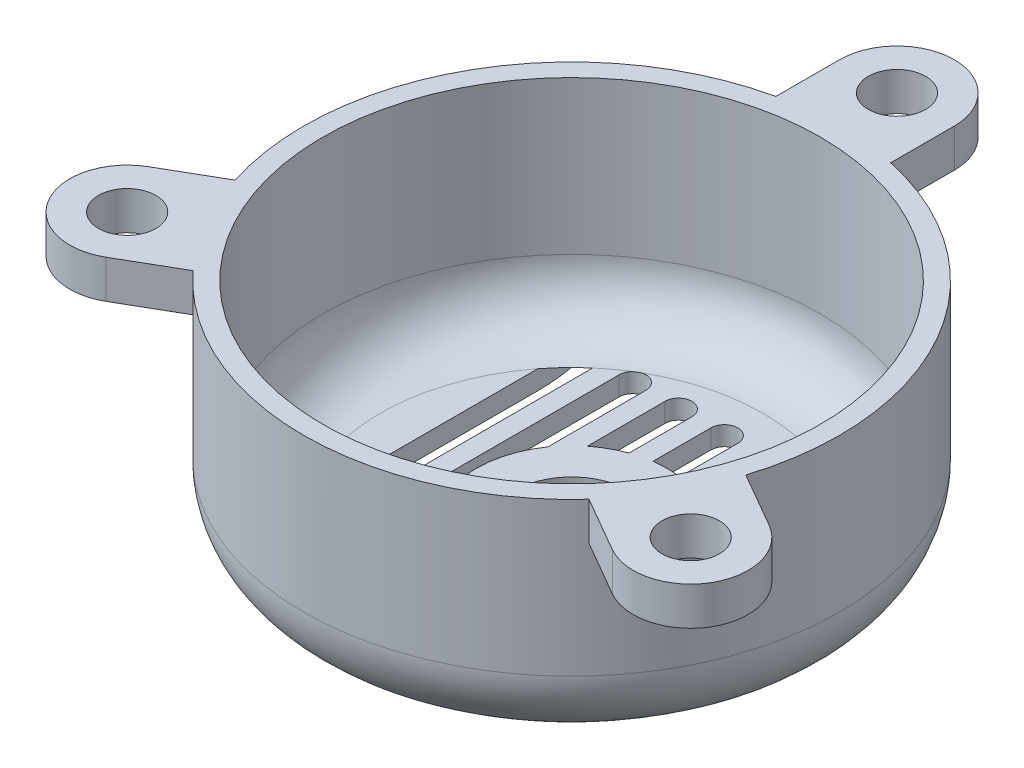
from build123d import *

# Parameters (mm, degrees)
SKETCH2_R           = 88.9
BOSS_EXTRUDE1_DEPTH = 76.2
FILLET1_R           = 25.4
SHELL1_T            = -6.35
CUT_EXTRUDE1_REACH  = 145.824
SKETCH6_R           = 31.75
BOSS_EXTRUDE2_DEPTH = 19.05
CUT_EXTRUDE2_REACH  = 155.979
SKETCH7_R           = 19.05
BOSS_EXTRUDE3_START = -12.7
SKETCH9_R           = 9.525
BOSS_EXTRUDE3_DEPTH = 12.7
CIRPATTERN1_COUNT   = 3


with BuildPart() as part:
    # Sketch2 → Boss-Extrude1 (new body)
    with BuildSketch(Plane(origin=(0, 0, 0), x_dir=(1, 0, 0), z_dir=(0, 1, 0))):
        with Locations(Location((0, 0, 0), (0, 0, 90))):
            Circle(SKETCH2_R)
    extrude(amount=BOSS_EXTRUDE1_DEPTH)

    # Fillet1
    fillet1_edges = [part.edges().sort_by_distance(p)[0] for p in [
        (0, 0, 88.9),
    ]]
    fillet(fillet1_edges, radius=FILLET1_R)

    # Shell1
    shell1_openings = [part.faces().sort_by_distance(p)[0] for p in [
        (0, 76.2, 0),
    ]]
    offset(amount=SHELL1_T, openings=shell1_openings, kind=Kind.INTERSECTION)

    # Sketch3 → Cut-Extrude1 (cut, up to next)
    with BuildSketch(Plane(origin=(0, 6.35, 0), x_dir=(1, 0, 0), z_dir=(0, 1, 0)), mode=Mode.PRIVATE) as cut_extrude1_sk1:
        with BuildLine():
            Line((50.165, 50.699645362), (50.165, -50.900354638))
            ThreePointArc((50.165, -50.900354638), (45.72, -55.345354638), (41.275, -50.900354638))
            Line((41.275, -50.900354638), (41.275, 50.699645362))
            ThreePointArc((41.275, 50.699645362), (45.72, 55.144645362), (50.165, 50.699645362))
        make_face()
    cut_extrude1_tool1 = extrude(cut_extrude1_sk1.sketch, amount=-CUT_EXTRUDE1_REACH, mode=Mode.PRIVATE) & part.part
    # Sketch3 → Cut-Extrude1 (cut, up to next)
    with BuildSketch(Plane(origin=(0, 6.35, 0), x_dir=(1, 0, 0), z_dir=(0, 1, 0)), mode=Mode.PRIVATE) as cut_extrude1_sk2:
        with BuildLine():
            Line((26.035, 50.699645362), (26.035, -50.900354638))
            ThreePointArc((26.035, -50.900354638), (30.48, -55.345354638), (34.925, -50.900354638))
            Line((34.925, -50.900354638), (34.925, 50.699645362))
            ThreePointArc((34.925, 50.699645362), (30.48, 55.144645362), (26.035, 50.699645362))
        make_face()
    cut_extrude1_tool2 = extrude(cut_extrude1_sk2.sketch, amount=-CUT_EXTRUDE1_REACH, mode=Mode.PRIVATE) & part.part
    # Sketch3 → Cut-Extrude1 (cut, up to next)
    with BuildSketch(Plane(origin=(0, 6.35, 0), x_dir=(1, 0, 0), z_dir=(0, 1, 0)), mode=Mode.PRIVATE) as cut_extrude1_sk3:
        with BuildLine():
            Line((10.795, 50.699645362), (10.795, -50.900354638))
            ThreePointArc((10.795, -50.900354638), (15.24, -55.345354638), (19.685, -50.900354638))
            Line((19.685, -50.900354638), (19.685, 50.699645362))
            ThreePointArc((19.685, 50.699645362), (15.24, 55.144645362), (10.795, 50.699645362))
        make_face()
    cut_extrude1_tool3 = extrude(cut_extrude1_sk3.sketch, amount=-CUT_EXTRUDE1_REACH, mode=Mode.PRIVATE) & part.part
    # Sketch3 → Cut-Extrude1 (cut, up to next)
    with BuildSketch(Plane(origin=(0, 6.35, 0), x_dir=(1, 0, 0), z_dir=(0, 1, 0)), mode=Mode.PRIVATE) as cut_extrude1_sk4:
        with BuildLine():
            Line((-4.445, 50.699645362), (-4.445, -50.900354638))
            ThreePointArc((-4.445, -50.900354638), (0, -55.345354638), (4.445, -50.900354638))
            Line((4.445, -50.900354638), (4.445, 50.699645362))
            ThreePointArc((4.445, 50.699645362), (0, 55.144645362), (-4.445, 50.699645362))
        make_face()
    cut_extrude1_tool4 = extrude(cut_extrude1_sk4.sketch, amount=-CUT_EXTRUDE1_REACH, mode=Mode.PRIVATE) & part.part
    # Sketch3 → Cut-Extrude1 (cut, up to next)
    with BuildSketch(Plane(origin=(0, 6.35, 0), x_dir=(1, 0, 0), z_dir=(0, 1, 0)), mode=Mode.PRIVATE) as cut_extrude1_sk5:
        with BuildLine():
            Line((-19.685, 50.699645362), (-19.685, -50.900354638))
            ThreePointArc((-19.685, -50.900354638), (-15.24, -55.345354638), (-10.795, -50.900354638))
            Line((-10.795, -50.900354638), (-10.795, 50.699645362))
            ThreePointArc((-10.795, 50.699645362), (-15.24, 55.144645362), (-19.685, 50.699645362))
        make_face()
    cut_extrude1_tool5 = extrude(cut_extrude1_sk5.sketch, amount=-CUT_EXTRUDE1_REACH, mode=Mode.PRIVATE) & part.part
    # Sketch3 → Cut-Extrude1 (cut, up to next)
    with BuildSketch(Plane(origin=(0, 6.35, 0), x_dir=(1, 0, 0), z_dir=(0, 1, 0)), mode=Mode.PRIVATE) as cut_extrude1_sk6:
        with BuildLine():
            Line((-34.925, 50.699645362), (-34.925, -50.900354638))
            ThreePointArc((-34.925, -50.900354638), (-30.48, -55.345354638), (-26.035, -50.900354638))
            Line((-26.035, -50.900354638), (-26.035, 50.699645362))
            ThreePointArc((-26.035, 50.699645362), (-30.48, 55.144645362), (-34.925, 50.699645362))
        make_face()
    cut_extrude1_tool6 = extrude(cut_extrude1_sk6.sketch, amount=-CUT_EXTRUDE1_REACH, mode=Mode.PRIVATE) & part.part
    # Sketch3 → Cut-Extrude1 (cut, up to next)
    with BuildSketch(Plane(origin=(0, 6.35, 0), x_dir=(1, 0, 0), z_dir=(0, 1, 0)), mode=Mode.PRIVATE) as cut_extrude1_sk7:
        with BuildLine():
            Line((-50.165, 50.699645362), (-50.165, -50.900354638))
            ThreePointArc((-50.165, -50.900354638), (-45.72, -55.345354638), (-41.275, -50.900354638))
            Line((-41.275, -50.900354638), (-41.275, 50.699645362))
            ThreePointArc((-41.275, 50.699645362), (-45.72, 55.144645362), (-50.165, 50.699645362))
        make_face()
    cut_extrude1_tool7 = extrude(cut_extrude1_sk7.sketch, amount=-CUT_EXTRUDE1_REACH, mode=Mode.PRIVATE) & part.part
    add(cut_extrude1_tool1.solids().sort_by_distance((45.72, 6.35, 0.100355))[0], mode=Mode.SUBTRACT)
    add(cut_extrude1_tool2.solids().sort_by_distance((30.48, 6.35, 0.100355))[0], mode=Mode.SUBTRACT)
    add(cut_extrude1_tool3.solids().sort_by_distance((15.24, 6.35, 0.100355))[0], mode=Mode.SUBTRACT)
    add(cut_extrude1_tool4.solids().sort_by_distance((0, 6.35, 0.100355))[0], mode=Mode.SUBTRACT)
    add(cut_extrude1_tool5.solids().sort_by_distance((-15.24, 6.35, 0.100355))[0], mode=Mode.SUBTRACT)
    add(cut_extrude1_tool6.solids().sort_by_distance((-30.48, 6.35, 0.100355))[0], mode=Mode.SUBTRACT)
    add(cut_extrude1_tool7.solids().sort_by_distance((-45.72, 6.35, 0.100355))[0], mode=Mode.SUBTRACT)

    # Sketch6 → Boss-Extrude2 (add)
    with BuildSketch(Plane(origin=(0, 6.35, 0), x_dir=(1, 0, 0), z_dir=(0, 1, 0))):
        with Locations(Location((0, 0, 0), (0, 0, 270))):
            Circle(SKETCH6_R)
    extrude(amount=-BOSS_EXTRUDE2_DEPTH)

    # Sketch7 → Cut-Extrude2 (cut, up to next)
    with BuildSketch(Plane.XZ.offset(12.7), mode=Mode.PRIVATE) as cut_extrude2_sk1:
        with Locations(Location((0, 0, 0), (0, 0, 270))):
            Circle(SKETCH7_R)
    cut_extrude2_tool1 = extrude(cut_extrude2_sk1.sketch, amount=-CUT_EXTRUDE2_REACH, mode=Mode.PRIVATE) & part.part
    add(cut_extrude2_tool1.solids().sort_by_distance((0, -12.7, 0))[0], mode=Mode.SUBTRACT)

    # Sketch9 → Boss-Extrude3 (add)
    with BuildSketch(Plane(origin=(0, 76.2, 0), x_dir=(1, 0, 0), z_dir=(0, 1, 0)).offset(BOSS_EXTRUDE3_START)):
        with BuildLine():
            Line((-19.05, 107.95), (-19.05, 86.834944003))
            ThreePointArc((-19.05, 86.834944003), (0, 88.9), (19.05, 86.834944003))
            Line((19.05, 86.834944003), (19.05, 107.95))
            ThreePointArc((19.05, 107.95), (0, 127), (-19.05, 107.95))
        make_face()
        with Locations(Location((0, 107.95, 0), (0, 0, 270))):
            Circle(SKETCH9_R, mode=Mode.SUBTRACT)
    boss_extrude3 = extrude(amount=BOSS_EXTRUDE3_DEPTH)

    # CirPattern1: Boss-Extrude3 ×3 about axis
    cirpattern1_axis = Axis((0, 0, 0), (0, 1, 0))
    for i in range(1, CIRPATTERN1_COUNT):
        add(boss_extrude3.rotate(cirpattern1_axis, i * 360 / CIRPATTERN1_COUNT))


solid = part.part
